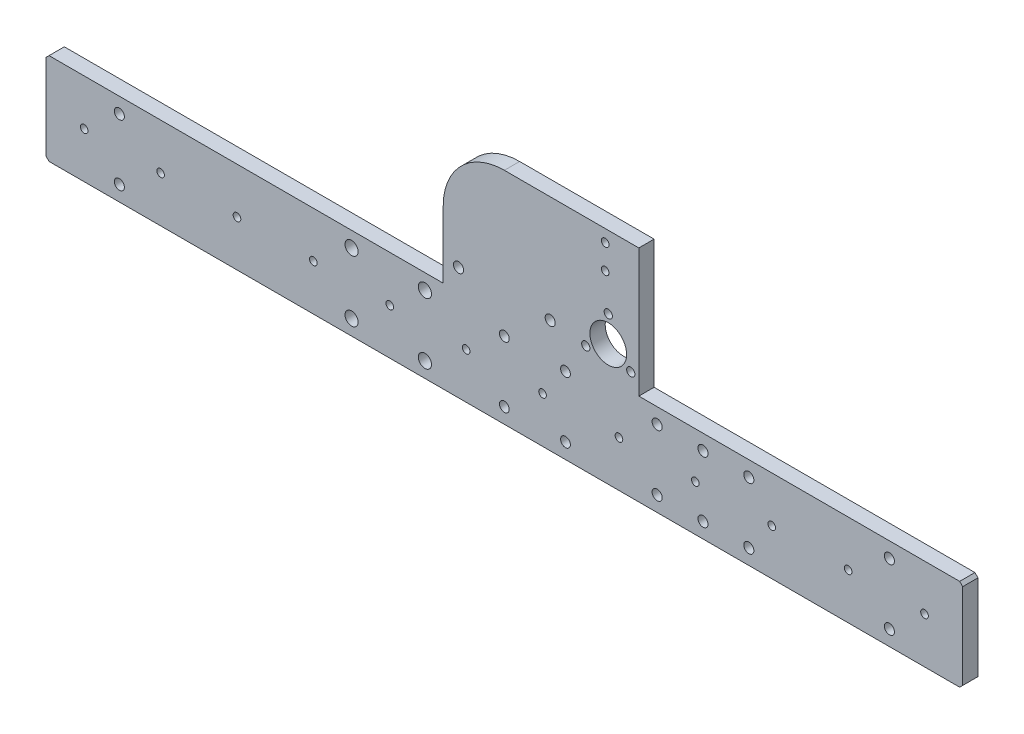
from build123d import *

# Parameters (mm, degrees)
SKETCH_1_W                 = 300
SKETCH_1_H                 = 30
EXTRUDE_1_DEPTH            = 5
CHAMFER_1_SIZE             = 1
HOLE_WIZARD_M3_1_D         = 3.2
M3X0_5_1_D                 = 2.5
M4X0_7_1_D                 = 3.3
M4X0_7_2_D                 = 3.3
PATTERN_LINEAR_1_COUNT     = 6
PATTERN_LINEAR_1_PITCH     = 25
PATTERN_LINEAR_1_COL_COUNT = 7
PATTERN_LINEAR_1_COL_PITCH = 25
EXTRUDE_3_DEPTH            = 5
SKETCH_13_R                = 6
CUT_EXTRUDE_2_DEPTH        = 161.542829177
HOLE_WIZARD_M2_5_1_D       = 2.7
M4X0_7_3_D                 = 3.3
HOLE_WIZARD_M4_1_D         = 4.3
M3X0_5_2_D                 = 2.5
PATTERN_CIRCULAR_1_COUNT   = 3


with BuildPart() as part:
    # 草圖1 → 填料-伸長1 (new body)
    with BuildSketch(Plane.XY):
        Rectangle(SKETCH_1_W, SKETCH_1_H)
    extrude(amount=EXTRUDE_1_DEPTH)

    # 導角1
    chamfer_1_edges = [part.edges().sort_by_distance(p)[0] for p in [
        (150, -15, 2.5),
        (-150, -15, 2.5),
        (-150, 15, 2.5),
        (150, 15, 2.5),
    ]]
    chamfer(chamfer_1_edges, length=CHAMFER_1_SIZE)

    # M3 餘隙孔1 (through all)
    with Locations(Plane.XY.offset(5)):
        with Locations((20, -10), (20, 10), (0, -10), (0, 10)):
            Hole(HOLE_WIZARD_M3_1_D / 2)

    # M3x0.5 螺紋孔1 (through all)
    with Locations(Plane.XY.offset(5)):
        with Locations((-12.5, 0)):
            m3x0_5_1 = Hole(M3X0_5_1_D / 2)

    # M4x0.7 螺紋孔1 (through all)
    with Locations(Plane.XY.offset(5)):
        with Locations((80, 10), (50, -10), (50, 10), (80, -10), (65, 10), (65, -10)):
            Hole(M4X0_7_1_D / 2)

    # M4x0.7 螺紋孔2 (through all)
    with Locations(Plane.XY.offset(5)):
        with Locations((-126, 10), (-126, -10)):
            m4x0_7_2 = Hole(M4X0_7_2_D / 2)

    # 直線複製排列1: M3x0.5 螺紋孔1 ×6
    with Locations(*[(-i * PATTERN_LINEAR_1_PITCH, 0, 0) for i in range(1, PATTERN_LINEAR_1_COUNT)]):
        add(m3x0_5_1, mode=Mode.SUBTRACT)

    # 直線複製排列1 col: M3x0.5 螺紋孔1 ×7
    with Locations(*[(i * PATTERN_LINEAR_1_COL_PITCH, 0, 0) for i in range(1, PATTERN_LINEAR_1_COL_COUNT)]):
        add(m3x0_5_1, mode=Mode.SUBTRACT)

    # 鏡射1: M4x0.7 螺紋孔2 across plane
    add(m4x0_7_2.mirror(Plane(origin=(0, 0, 0), x_dir=(0, 0, 1), z_dir=(1, 0, 0))), mode=Mode.SUBTRACT)

    # 草圖16 → 填料-伸長3 (add, through all)
    with BuildSketch(Plane.XY):
        with BuildLine():
            Line((-20, 15), (44, 15))
            Line((44, 15), (44, 57))
            Line((44, 57), (0, 57))
            ThreePointArc((0, 57), (-14.142135624, 51.142135624), (-20, 37))
            Line((-20, 37), (-20, 15))
        make_face()
    extrude(amount=EXTRUDE_3_DEPTH)

    # 草圖13 → 除料-伸長2 (cut, through all)
    with BuildSketch(Plane.XY):
        with Locations(Location((34, 24.8, 0), (0, 0, 180))):
            Circle(SKETCH_13_R)
    extrude(amount=CUT_EXTRUDE_2_DEPTH, mode=Mode.SUBTRACT)

    # M2.5 餘隙孔1 (through all)
    with Locations(Plane.XY.offset(5)):
        with Locations((34, 33.3)):
            hole_wizard_m2_5_1 = Hole(HOLE_WIZARD_M2_5_1_D / 2)

    # M4x0.7 螺紋孔3 (through all)
    with Locations(Plane.XY.offset(5)):
        with Locations((15, 22), (-15, 22)):
            Hole(M4X0_7_3_D / 2)

    # M4 餘隙孔1 (through all)
    with Locations(Plane.XY.offset(5)):
        with Locations((-26, -10), (-26, 10), (-50, -10), (-50, 10)):
            Hole(HOLE_WIZARD_M4_1_D / 2)

    # M3x0.5 螺紋孔2 (through all)
    with Locations(Plane.XY.offset(5)):
        with Locations((33, 53), (33, 45)):
            Hole(M3X0_5_2_D / 2)

    # 環狀複製排列1: M2.5 餘隙孔1 ×3 about axis
    pattern_circular_1_axis = Axis((34, 24.8, 0), (0, 0, 1))
    for i in range(1, PATTERN_CIRCULAR_1_COUNT):
        add(hole_wizard_m2_5_1.rotate(pattern_circular_1_axis, i * 360 / PATTERN_CIRCULAR_1_COUNT), mode=Mode.SUBTRACT)


solid = part.part
